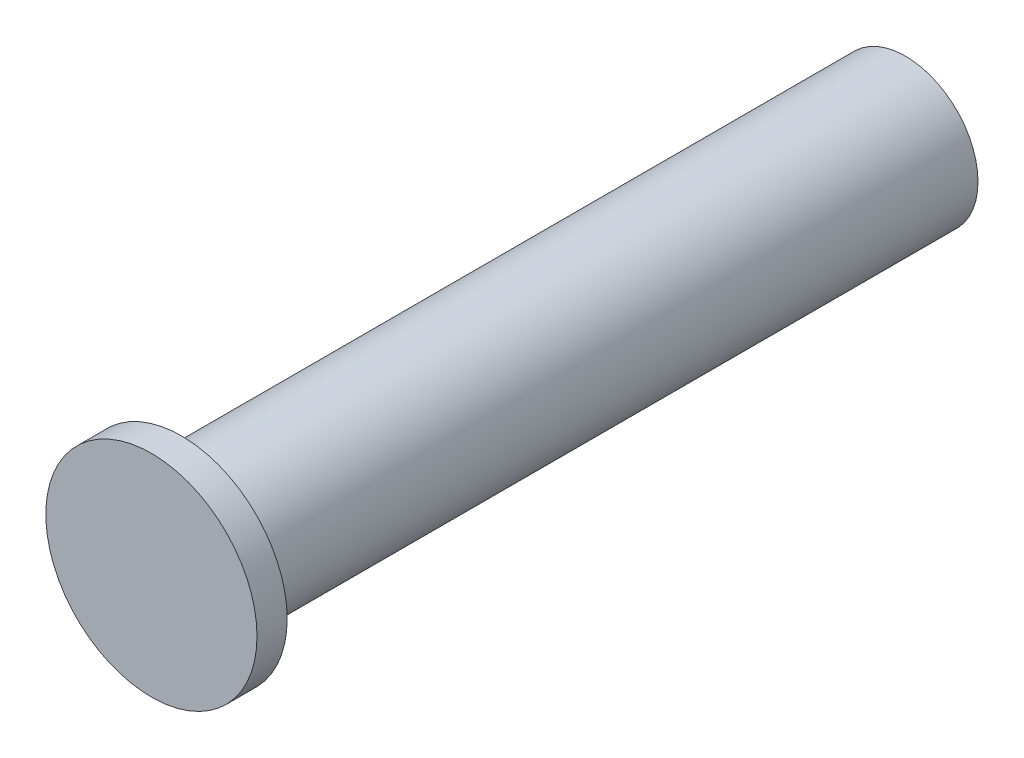
from build123d import *

# Parameters (mm, degrees)
SKETCH1_R           = 4.8
BOSS_EXTRUDE1_DEPTH = 48
SKETCH2_R           = 7
BOSS_EXTRUDE2_DEPTH = 2


with BuildPart() as part:
    # Sketch1 → Boss-Extrude1 (new body)
    with BuildSketch(Plane.XY):
        Circle(SKETCH1_R)
    extrude(amount=BOSS_EXTRUDE1_DEPTH)

    # Sketch2 → Boss-Extrude2 (add)
    with BuildSketch(Plane.XY.offset(48)):
        Circle(SKETCH2_R)
    extrude(amount=BOSS_EXTRUDE2_DEPTH)


solid = part.part
